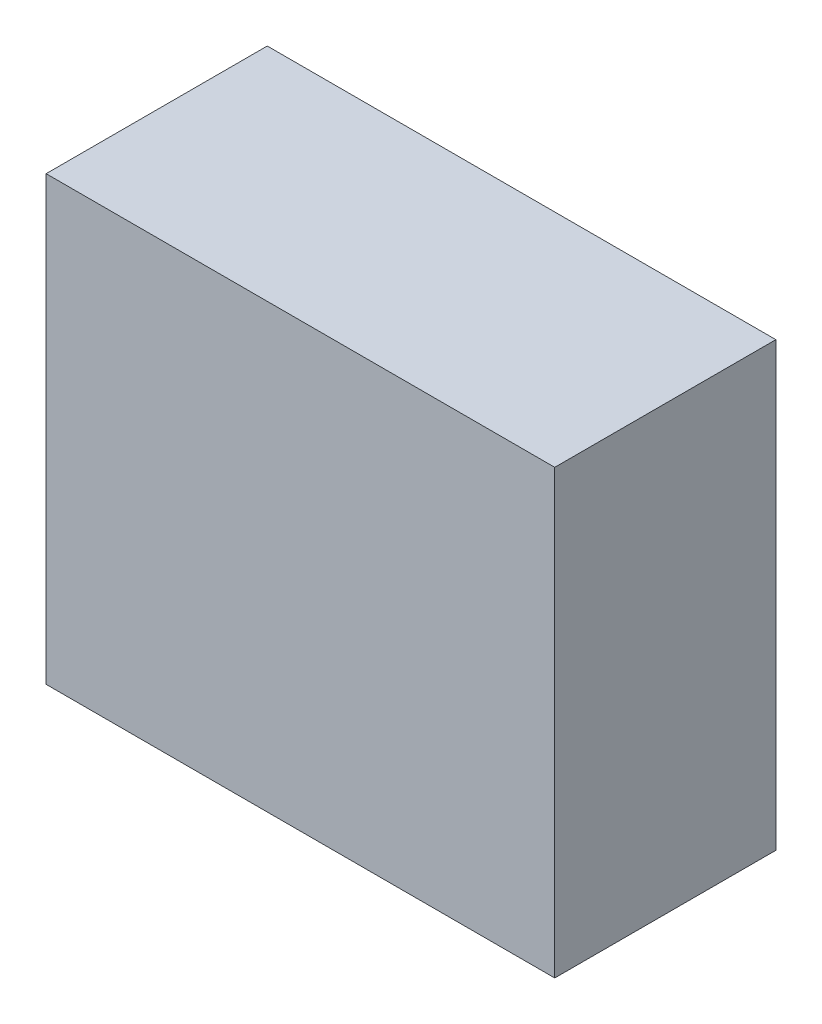
from build123d import *

# Parameters (mm, degrees)
SKETCH1_W           = 23
SKETCH1_H           = 20
BOSS_EXTRUDE1_DEPTH = 10


with BuildPart() as part:
    # Sketch1 → Boss-Extrude1 (new body)
    with BuildSketch(Plane.XY):
        with Locations((11.5, 10)):
            Rectangle(SKETCH1_W, SKETCH1_H)
    extrude(amount=BOSS_EXTRUDE1_DEPTH)


solid = part.part
